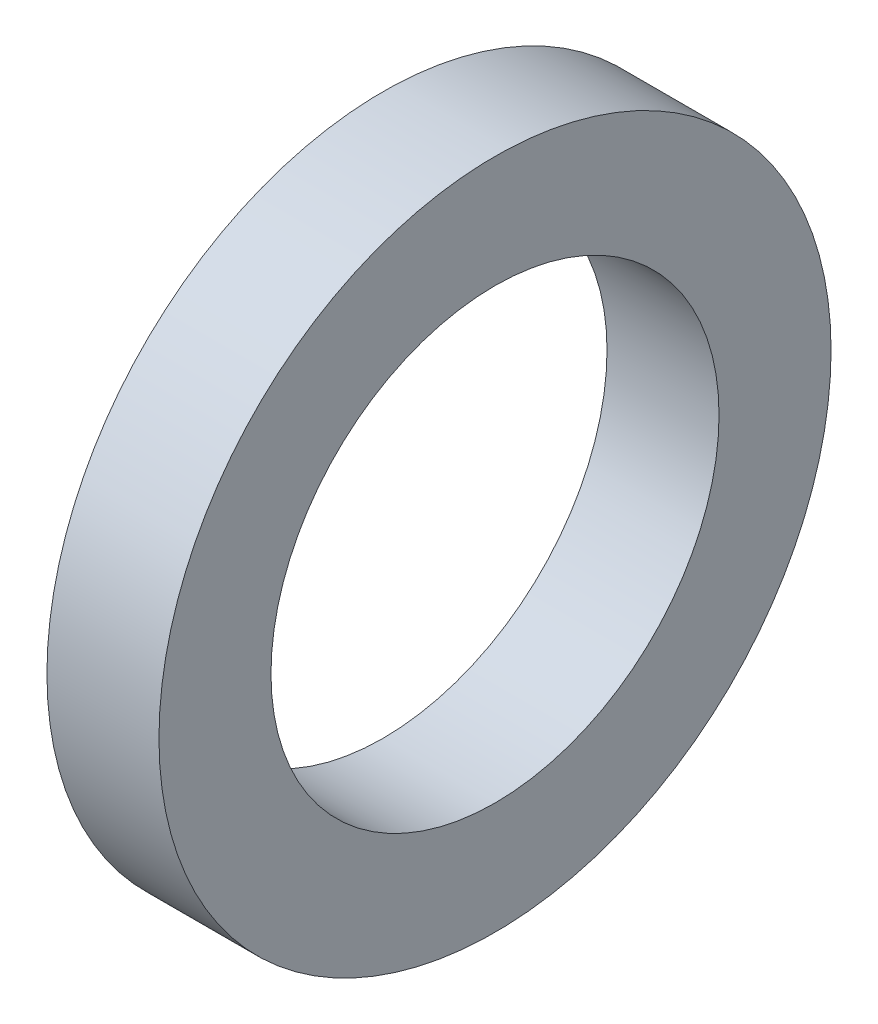
from build123d import *

# Parameters (mm, degrees)
SKETCH1_R           = 3
SKETCH1_R_2         = 2
BOSS_EXTRUDE1_DEPTH = 1


with BuildPart() as part:
    # Sketch1 → Boss-Extrude1 (new body)
    with BuildSketch(Plane(origin=(0, 0, 0), x_dir=(0, 0, -1), z_dir=(1, 0, 0))):
        Circle(SKETCH1_R)
        Circle(SKETCH1_R_2, mode=Mode.SUBTRACT)
    extrude(amount=BOSS_EXTRUDE1_DEPTH)


solid = part.part
